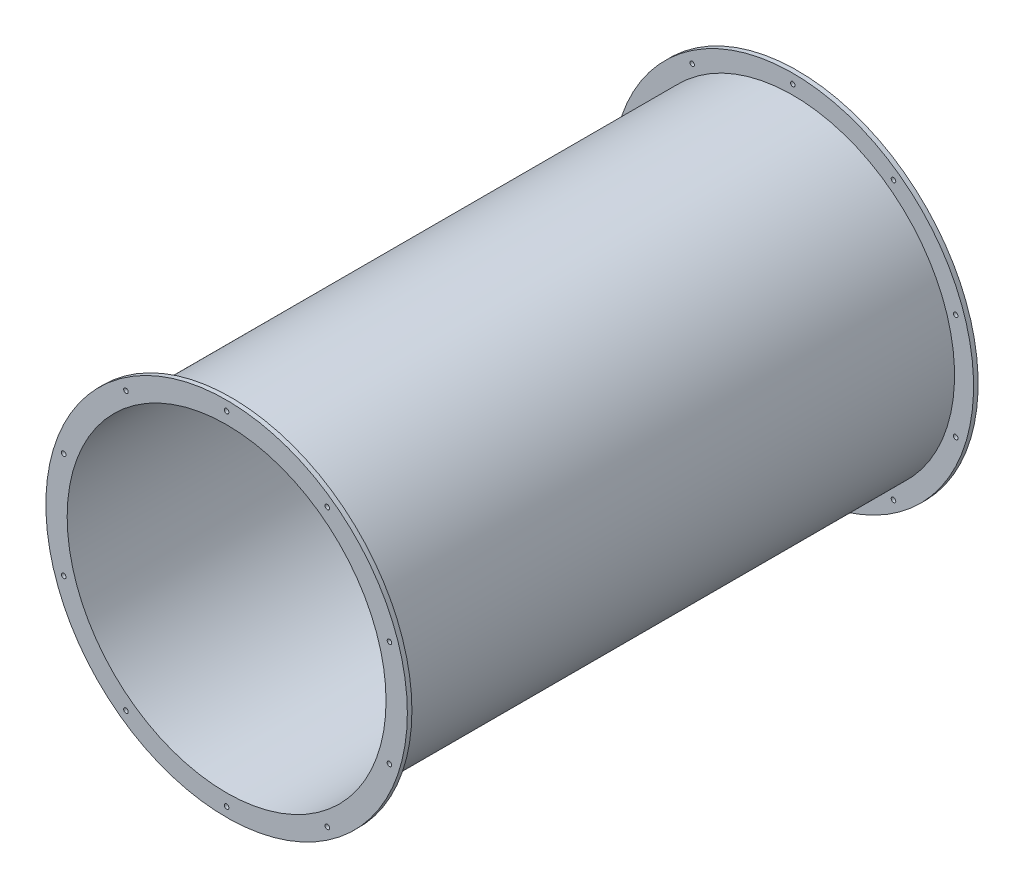
from build123d import *

# Parameters (mm, degrees)
SKETCH1_R           = 425
SKETCH1_R_2         = 419
BOSS_EXTRUDE1_DEPTH = 1500
BOSS_EXTRUDE2_START = -12
SKETCH2_R           = 475
SKETCH2_R_2         = 425
BOSS_EXTRUDE2_DEPTH = 12
SKETCH4_R           = 475
SKETCH4_R_2         = 425
BOSS_EXTRUDE3_DEPTH = 12
SKETCH6_R           = 6
CUT_EXTRUDE3_DEPTH  = 1644.547991389


with BuildPart() as part:
    # Sketch1 → Boss-Extrude1 (new body)
    with BuildSketch(Plane.XY):
        Circle(SKETCH1_R)
        Circle(SKETCH1_R_2, mode=Mode.SUBTRACT)
    extrude(amount=BOSS_EXTRUDE1_DEPTH)

    # Sketch2 → Boss-Extrude2 (add)
    with BuildSketch(Plane.XY.offset(1500).offset(BOSS_EXTRUDE2_START)):
        Circle(SKETCH2_R)
        Circle(SKETCH2_R_2, mode=Mode.SUBTRACT)
    extrude(amount=BOSS_EXTRUDE2_DEPTH)

    # Sketch4 → Boss-Extrude3 (add)
    with BuildSketch(Plane(origin=(0, 0, 0), x_dir=(-1, 0, 0), z_dir=(0, 0, -1))):
        with Locations(Location((0, 0, 0), (0, 0, 180))):
            Circle(SKETCH4_R)
        Circle(SKETCH4_R_2, mode=Mode.SUBTRACT)
    extrude(amount=-BOSS_EXTRUDE3_DEPTH)

    # Sketch6 → Cut-Extrude3 (cut, through all)
    with BuildSketch(Plane.XY.offset(1500)):
        with Locations((0, 450)):
            Circle(SKETCH6_R)
        with Locations((264.503363532, 364.057647469)):
            Circle(SKETCH6_R)
        with Locations((427.975432333, 139.057647469)):
            Circle(SKETCH6_R)
        with Locations((427.975432333, -139.057647469)):
            Circle(SKETCH6_R)
        with Locations((264.503363532, -364.057647469)):
            Circle(SKETCH6_R)
        with Locations((0, -450)):
            Circle(SKETCH6_R)
        with Locations((-264.503363532, -364.057647469)):
            Circle(SKETCH6_R)
        with Locations((-427.975432333, -139.057647469)):
            Circle(SKETCH6_R)
        with Locations((-427.975432333, 139.057647469)):
            Circle(SKETCH6_R)
        with Locations((-264.503363532, 364.057647469)):
            Circle(SKETCH6_R)
    extrude(amount=-CUT_EXTRUDE3_DEPTH, mode=Mode.SUBTRACT)


solid = part.part
